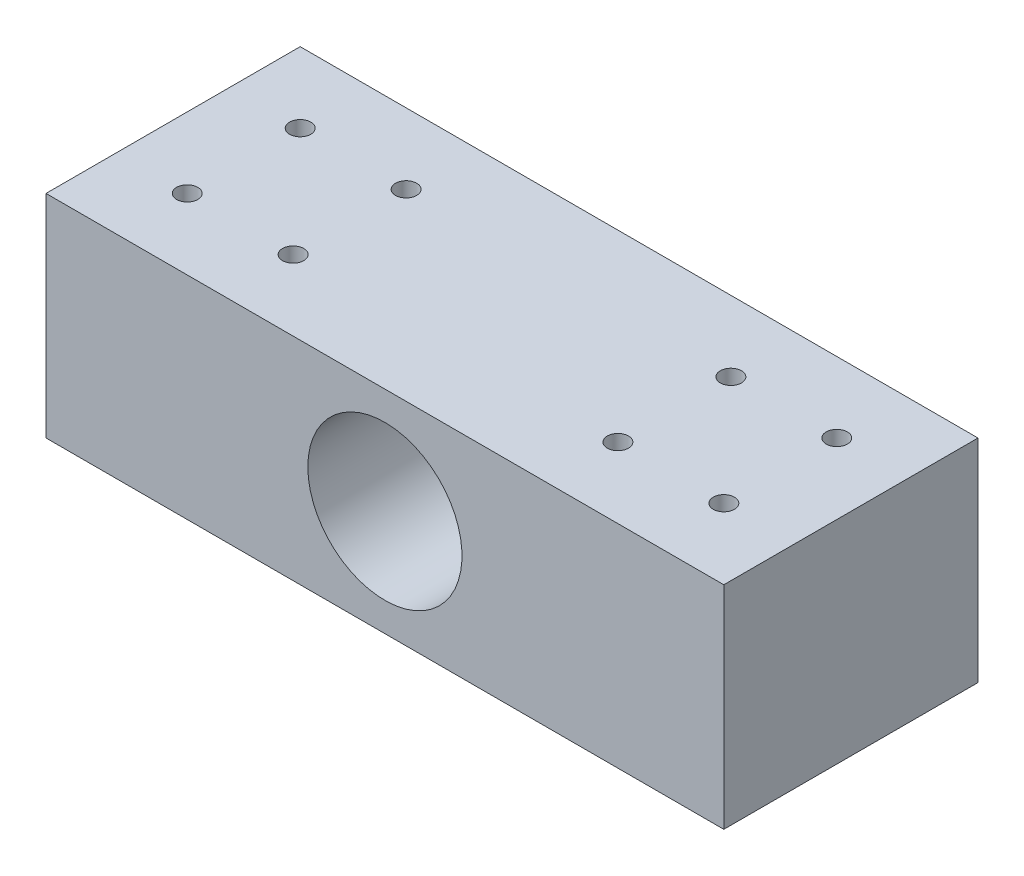
from build123d import *

# Parameters (mm, degrees)
SKETCH_1_W               = 96
SKETCH_1_H               = 36
SKETCH_1_R               = 1.5
EXTRUDE_1_DEPTH          = 30
CUT_EXTRUDE_1_DEPTH      = 107.826962889
CUT_EXTRUDE_1_DEPTH_BACK = 107.826962889
SKETCH_2_R               = 10.917502173


with BuildPart() as part:
    # 草图1 → 凸台-拉伸1 (new body)
    with BuildSketch(Plane(origin=(0, 0, 0), x_dir=(1, 0, 0), z_dir=(0, 1, 0))):
        with Locations((48, 18)):
            Rectangle(SKETCH_1_W, SKETCH_1_H)
        with Locations(Location((10, 26, 0), (0, 0, 270))):
            Circle(SKETCH_1_R, mode=Mode.SUBTRACT)
        with Locations(Location((25, 26, 0), (0, 0, 270))):
            Circle(SKETCH_1_R, mode=Mode.SUBTRACT)
        with Locations(Location((25, 10, 0), (0, 0, 270))):
            Circle(SKETCH_1_R, mode=Mode.SUBTRACT)
        with Locations(Location((10, 10, 0), (0, 0, 270))):
            Circle(SKETCH_1_R, mode=Mode.SUBTRACT)
        with Locations(Location((86, 26, 0), (0, 0, 90))):
            Circle(SKETCH_1_R, mode=Mode.SUBTRACT)
        with Locations(Location((86, 10, 0), (0, 0, 90))):
            Circle(SKETCH_1_R, mode=Mode.SUBTRACT)
        with Locations(Location((71, 10, 0), (0, 0, 90))):
            Circle(SKETCH_1_R, mode=Mode.SUBTRACT)
        with Locations(Location((71, 26, 0), (0, 0, 90))):
            Circle(SKETCH_1_R, mode=Mode.SUBTRACT)
    extrude(amount=EXTRUDE_1_DEPTH)

    # 草图2 → 切除-拉伸1 (cut, two sides: drawn at the far end of the back side and taken through both)
    with BuildSketch(Plane(origin=(0, 0, -36), x_dir=(-1, 0, 0), z_dir=(0, 0, -1)).offset(-CUT_EXTRUDE_1_DEPTH_BACK)):
        with Locations((-48, 15)):
            Circle(SKETCH_2_R)
    extrude(amount=CUT_EXTRUDE_1_DEPTH + CUT_EXTRUDE_1_DEPTH_BACK, mode=Mode.SUBTRACT)


solid = part.part
